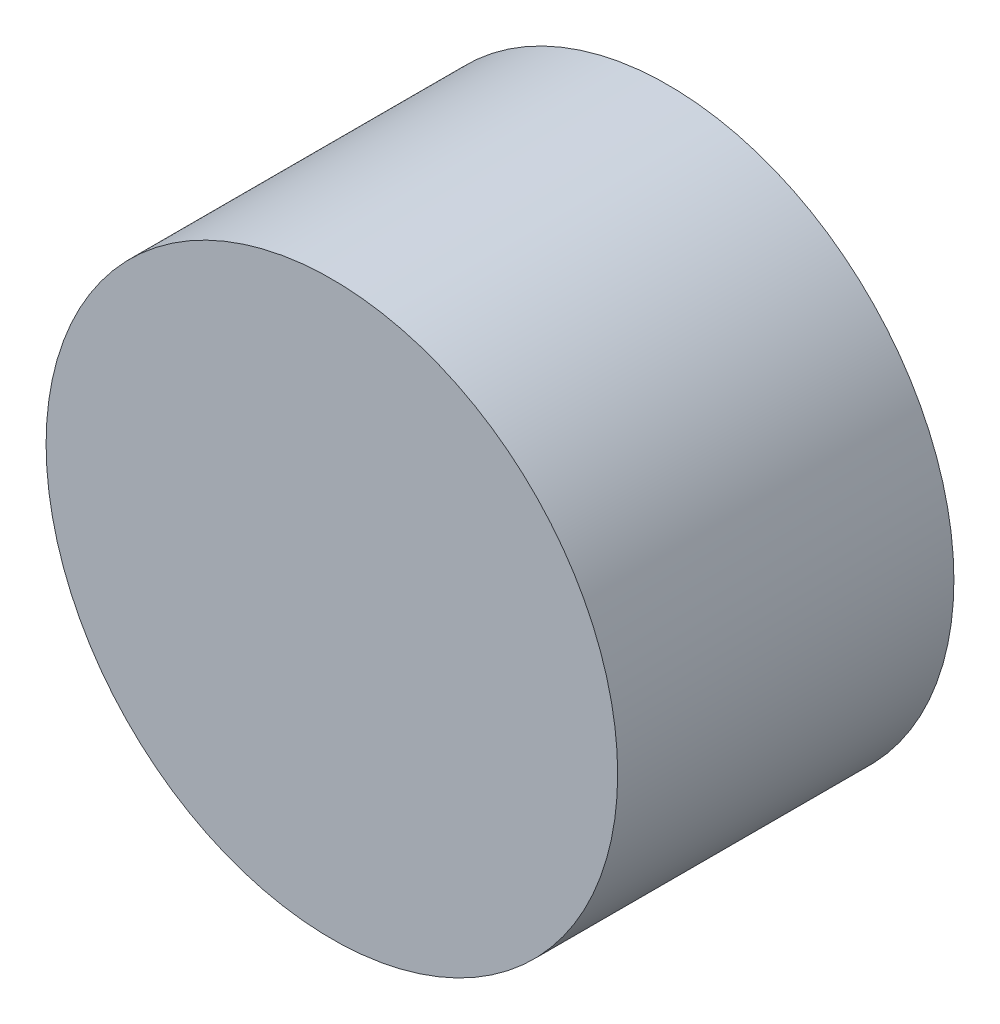
from build123d import *

# Parameters (mm, degrees)
SKETCH_1_R      = 1.7
EXTRUDE_1_DEPTH = 2


with BuildPart() as part:
    # 草图1 → 凸台-拉伸1 (new body)
    with BuildSketch(Plane.XY):
        Circle(SKETCH_1_R)
    extrude(amount=EXTRUDE_1_DEPTH)


solid = part.part
